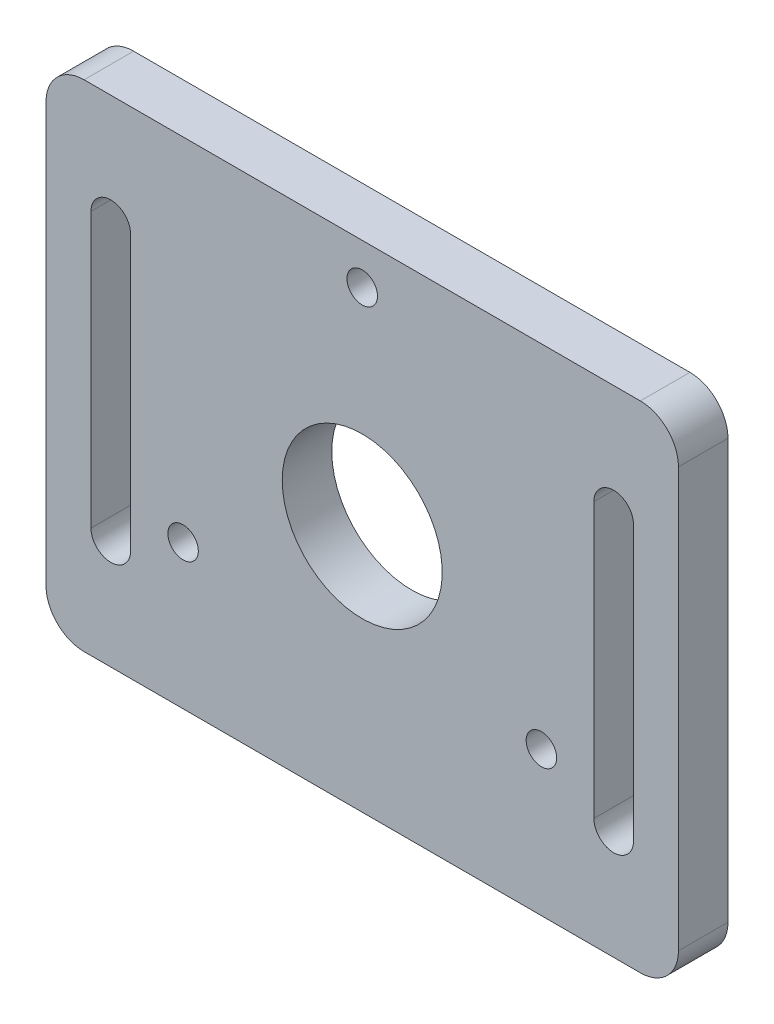
from build123d import *

# Parameters (mm, degrees)
SKETCH1_W           = 83
SKETCH1_H           = 65
SKETCH1_R           = 10.5
BOSS_EXTRUDE1_DEPTH = 6.5
FILLET1_R           = 5
SKETCH2_R           = 2
CUT_EXTRUDE1_DEPTH  = 10


with BuildPart() as part:
    # Sketch1 → Boss-Extrude1 (new body)
    with BuildSketch(Plane.XY):
        Rectangle(SKETCH1_W, SKETCH1_H)
        with Locations(Location((0, 0, 0), (0, 0, 180))):
            Circle(SKETCH1_R, mode=Mode.SUBTRACT)
        with BuildLine():
            Line((30.4, -18), (30.4, 18))
            ThreePointArc((30.4, 18), (33, 20.6), (35.6, 18))
            Line((35.6, 18), (35.6, -18))
            ThreePointArc((35.6, -18), (33, -20.6), (30.4, -18))
        make_face(mode=Mode.SUBTRACT)
        with BuildLine():
            Line((-30.4, -18), (-30.4, 18))
            ThreePointArc((-30.4, 18), (-33, 20.6), (-35.6, 18))
            Line((-35.6, 18), (-35.6, -18))
            ThreePointArc((-35.6, -18), (-33, -20.6), (-30.4, -18))
        make_face(mode=Mode.SUBTRACT)
    extrude(amount=BOSS_EXTRUDE1_DEPTH)

    # Fillet1
    fillet1_edges = [part.edges().sort_by_distance(p)[0] for p in [
        (-41.5, -32.5, 3.25),
        (-41.5, 32.5, 3.25),
        (41.5, 32.5, 3.25),
        (41.5, -32.5, 3.25),
    ]]
    fillet(fillet1_edges, radius=FILLET1_R)

    # Sketch2 → Cut-Extrude1 (cut)
    with BuildSketch(Plane.XY.offset(6.5)):
        with Locations((0, 27.15)):
            Circle(SKETCH2_R)
        with Locations((23.512589713, -13.575)):
            Circle(SKETCH2_R)
        with Locations((-23.512589713, -13.575)):
            Circle(SKETCH2_R)
    extrude(amount=-CUT_EXTRUDE1_DEPTH, mode=Mode.SUBTRACT)


solid = part.part
